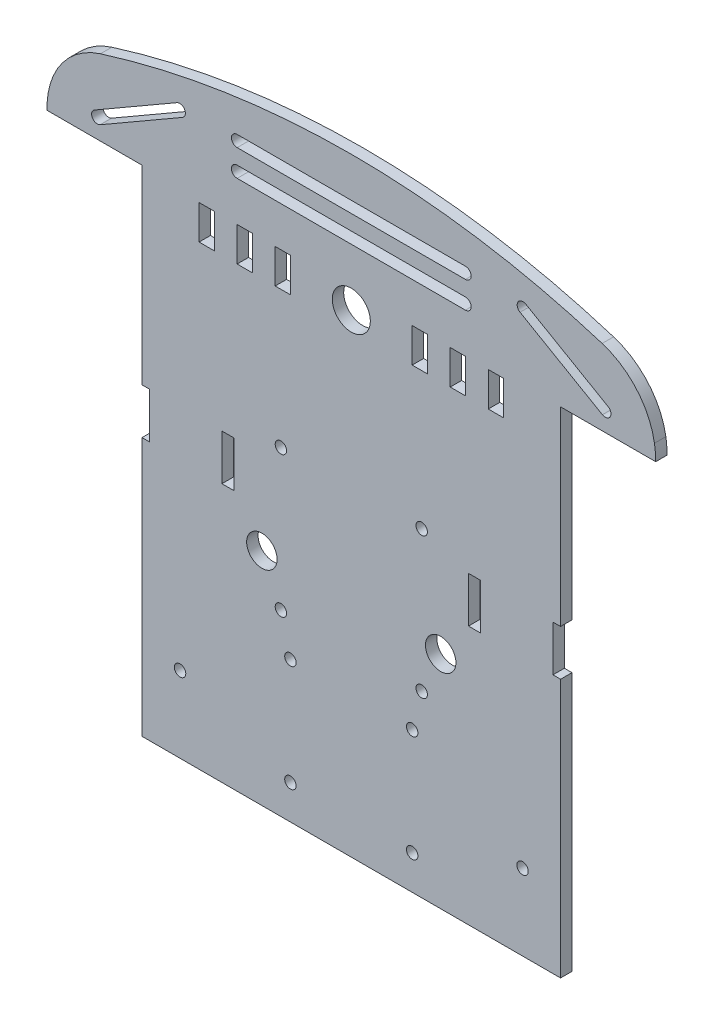
from build123d import *

# Parameters (mm, degrees)
EXTRUDE_1_DEPTH     = 3
CUT_EXTRUDE_1_DEPTH = 133.037873355
SKETCH_3_W          = 2
SKETCH_3_H          = 12
SKETCH_3_W_2        = 3.2
CUT_EXTRUDE_2_DEPTH = 133.037873355
SKETCH_4_R          = 4
CUT_EXTRUDE_3_DEPTH = 133.037873355
SKETCH_5_R          = 5
SKETCH_5_W          = 4
SKETCH_5_H          = 9
CUT_EXTRUDE_4_DEPTH = 133.037873355
SKETCH_6_R          = 1.5
CUT_EXTRUDE_5_DEPTH = 10
SKETCH_8_R          = 1.5
CUT_EXTRUDE_7_DEPTH = 133.037873355
SKETCH_9_R          = 1.5
CUT_EXTRUDE_8_DEPTH = 133.037873355


with BuildPart() as part:
    # 草图1 → 凸台-拉伸1 (new body)
    with BuildSketch(Plane.XY):
        with BuildLine():
            Line((55, -55), (-55, -55))
            Line((-55, -55), (-55, 75))
            Line((-55, 75), (-80, 75))
            ThreePointArc((-80, 75), (-79.917609458, 77.027988882), (-79.670980888, 79.042610796))
            ThreePointArc((-79.670980888, 79.042610796), (-75.043492411, 88.912306625), (-65.927615795, 94.889374375))
            ThreePointArc((-65.927615795, 94.889374375), (0, 105), (65.927615795, 94.889374375))
            ThreePointArc((65.927615795, 94.889374375), (75.043492411, 88.912306625), (79.670980888, 79.042610796))
            ThreePointArc((79.670980888, 79.042610796), (79.917609458, 77.027988882), (80, 75))
            Line((80, 75), (55, 75))
            Line((55, 75), (55, -55))
        make_face()
    extrude(amount=EXTRUDE_1_DEPTH)

    # 草图2 → 切除-拉伸1 (cut, through all)
    with BuildSketch(Plane(origin=(0, 0, 0), x_dir=(-1, 0, 0), z_dir=(0, 0, -1))):
        with BuildLine():
            Line((-30, 94.5), (30, 94.5))
            ThreePointArc((30, 94.5), (31.5, 93), (30, 91.5))
            Line((30, 91.5), (-30, 91.5))
            ThreePointArc((-30, 91.5), (-31.5, 93), (-30, 94.5))
        make_face()
        with BuildLine():
            Line((-67.497284367, 81.299038106), (-45.846649273, 93.799038106))
            ThreePointArc((-45.846649273, 93.799038106), (-43.797611167, 93.25), (-44.346649273, 91.200961894))
            Line((-44.346649273, 91.200961894), (-65.997284367, 78.700961894))
            ThreePointArc((-65.997284367, 78.700961894), (-68.046322473, 79.25), (-67.497284367, 81.299038106))
        make_face()
        with BuildLine():
            Line((65.997284367, 78.700961894), (44.346649273, 91.200961894))
            ThreePointArc((44.346649273, 91.200961894), (43.797611167, 93.25), (45.846649273, 93.799038106))
            Line((45.846649273, 93.799038106), (67.497284367, 81.299038106))
            ThreePointArc((67.497284367, 81.299038106), (68.046322473, 79.25), (65.997284367, 78.700961894))
        make_face()
        with BuildLine():
            Line((-30, 87.5), (30, 87.5))
            ThreePointArc((30, 87.5), (31.5, 86), (30, 84.5))
            Line((30, 84.5), (-30, 84.5))
            ThreePointArc((-30, 84.5), (-31.5, 86), (-30, 87.5))
        make_face()
    extrude(amount=-CUT_EXTRUDE_1_DEPTH, mode=Mode.SUBTRACT)

    # 草图3 → 切除-拉伸2 (cut, through all)
    with BuildSketch(Plane.XY.offset(3)):
        with Locations((-54, 19)):
            Rectangle(SKETCH_3_W, SKETCH_3_H)
        with Locations((-32.4, 19)):
            Rectangle(SKETCH_3_W_2, SKETCH_3_H)
        with Locations((32.4, 19)):
            Rectangle(SKETCH_3_W_2, SKETCH_3_H)
        with Locations((54, 19)):
            Rectangle(SKETCH_3_W, SKETCH_3_H)
    extrude(amount=-CUT_EXTRUDE_2_DEPTH, mode=Mode.SUBTRACT)

    # 草图4 → 切除-拉伸3 (cut, through all)
    with BuildSketch(Plane(origin=(0, 0, 0), x_dir=(-1, 0, 0), z_dir=(0, 0, -1))):
        with Locations((23.5, 3)):
            Circle(SKETCH_4_R)
        with Locations(Location((-23.5, 3, 0), (0, 0, 180))):
            Circle(SKETCH_4_R)
    extrude(amount=-CUT_EXTRUDE_3_DEPTH, mode=Mode.SUBTRACT)

    # 草图5 → 切除-拉伸4 (cut, through all)
    with BuildSketch(Plane(origin=(0, 0, 0), x_dir=(-1, 0, 0), z_dir=(0, 0, -1))):
        with Locations((0, 69.5)):
            Circle(SKETCH_5_R)
        with Locations((-38, 69.5)):
            Rectangle(SKETCH_5_W, SKETCH_5_H)
        with Locations((-28, 69.5)):
            Rectangle(SKETCH_5_W, SKETCH_5_H)
        with Locations((-18, 69.5)):
            Rectangle(SKETCH_5_W, SKETCH_5_H)
        with Locations((18, 69.5)):
            Rectangle(SKETCH_5_W, SKETCH_5_H)
        with Locations((28, 69.5)):
            Rectangle(SKETCH_5_W, SKETCH_5_H)
        with Locations((38, 69.5)):
            Rectangle(SKETCH_5_W, SKETCH_5_H)
    extrude(amount=-CUT_EXTRUDE_4_DEPTH, mode=Mode.SUBTRACT)

    # 草图6 → 切除-拉伸5 (cut)
    with BuildSketch(Plane(origin=(0, 0, 0), x_dir=(-1, 0, 0), z_dir=(0, 0, -1))):
        with Locations((18.5, 29)):
            Circle(SKETCH_6_R)
        with Locations((18.5, -8)):
            Circle(SKETCH_6_R)
        with Locations((-18.5, -8)):
            Circle(SKETCH_6_R)
        with Locations((-18.5, 29)):
            Circle(SKETCH_6_R)
    extrude(amount=-CUT_EXTRUDE_5_DEPTH, mode=Mode.SUBTRACT)

    # 草图8 → 切除-拉伸7 (cut, through all)
    with BuildSketch(Plane(origin=(0, 0, 0), x_dir=(-1, 0, 0), z_dir=(0, 0, -1))):
        with Locations((-16, -46)):
            Circle(SKETCH_8_R)
        with Locations((-16, -18)):
            Circle(SKETCH_8_R)
        with Locations((16, -18)):
            Circle(SKETCH_8_R)
        with Locations((16, -46)):
            Circle(SKETCH_8_R)
    extrude(amount=-CUT_EXTRUDE_7_DEPTH, mode=Mode.SUBTRACT)

    # 草图9 → 切除-拉伸8 (cut, through all)
    with BuildSketch(Plane(origin=(0, 0, 0), x_dir=(-1, 0, 0), z_dir=(0, 0, -1))):
        with Locations((-45, -35)):
            Circle(SKETCH_9_R)
        with Locations((45, -35)):
            Circle(SKETCH_9_R)
    extrude(amount=-CUT_EXTRUDE_8_DEPTH, mode=Mode.SUBTRACT)


solid = part.part
